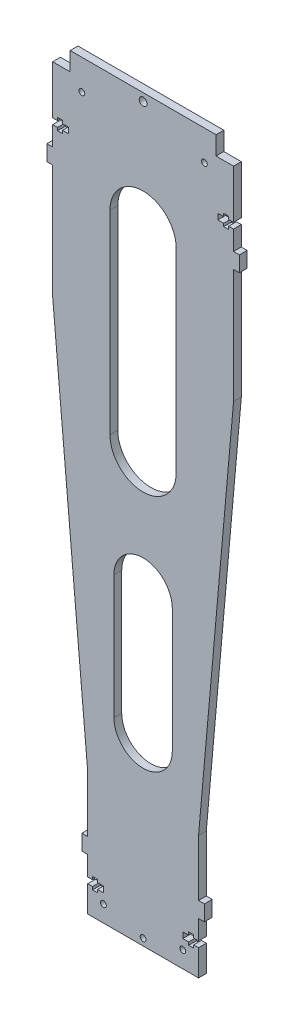
from build123d import *

# Parameters (mm, degrees)
SKETCH_3_R      = 1.5
SKETCH_3_R_2    = 2
EXTRUDE_1_DEPTH = 4


with BuildPart() as part:
    # 草图3 → 凸台-拉伸1 (new body)
    with BuildSketch(Plane.XY):
        Polygon((-46.5, 5.009783315), (-37.5, 5.009783315), (-37.5, 14.509783315), (37.5, 14.509783315), (37.5, 5.009783315), (46.5, 5.009783315), (46.5, -19.990216685), (44, -19.990216685), (44, -18.490216685), (41.4, -18.490216685), (41.4, -19.990216685), (38.4, -19.990216685), (38.4, -22.990216685), (41.4, -22.990216685), (41.4, -24.490216685), (44, -24.490216685), (44, -22.990216685), (46.5, -22.990216685), (46.5, -32.990216685), (49.5, -32.990216685), (49.5, -40.990216685), (46.5, -40.990216685), (46.5, -99.795048798), (28.5, -301.990216685), (28.5, -330.990216685), (31.5, -330.990216685), (31.5, -338.990216685), (28.5, -338.990216685), (28.5, -348.990216685), (26, -348.990216685), (26, -347.490216685), (23.4, -347.490216685), (23.4, -348.990216685), (20.4, -348.990216685), (20.4, -351.990216685), (23.4, -351.990216685), (23.4, -353.490216685), (26, -353.490216685), (26, -351.990216685), (28.5, -351.990216685), (28.5, -365.490216685), (-28.5, -365.490216685), (-28.5, -351.990216685), (-26, -351.990216685), (-26, -353.490216685), (-23.4, -353.490216685), (-23.4, -351.990216685), (-20.4, -351.990216685), (-20.4, -348.990216685), (-23.4, -348.990216685), (-23.4, -347.490216685), (-26, -347.490216685), (-26, -348.990216685), (-28.5, -348.990216685), (-28.5, -338.990216685), (-31.5, -338.990216685), (-31.5, -330.990216685), (-28.5, -330.990216685), (-28.5, -301.990216685), (-46.5, -99.795048798), (-46.5, -40.990216685), (-49.5, -40.990216685), (-49.5, -32.990216685), (-46.5, -32.990216685), (-46.5, -22.990216685), (-44, -22.990216685), (-44, -24.490216685), (-41.4, -24.490216685), (-41.4, -22.990216685), (-38.4, -22.990216685), (-38.4, -19.990216685), (-41.4, -19.990216685), (-41.4, -18.490216685), (-44, -18.490216685), (-44, -19.990216685), (-46.5, -19.990216685), align=None)
        with Locations((-31.5, -0.990216685)):
            Circle(SKETCH_3_R, mode=Mode.SUBTRACT)
        with Locations((0, 10.509783315)):
            Circle(SKETCH_3_R_2, mode=Mode.SUBTRACT)
        with Locations(Location((31.5, -0.990216685, 0), (0, 0, 180))):
            Circle(SKETCH_3_R, mode=Mode.SUBTRACT)
        with Locations((0, -361.990216685)):
            Circle(SKETCH_3_R, mode=Mode.SUBTRACT)
        with Locations((-20.4, -356.990216685)):
            Circle(SKETCH_3_R, mode=Mode.SUBTRACT)
        with Locations(Location((20.4, -356.990216685, 0), (0, 0, 180))):
            Circle(SKETCH_3_R, mode=Mode.SUBTRACT)
        with BuildLine():
            Line((-17.023193691, -146.328074808), (-17.023193691, -46.328074808))
            ThreePointArc((-17.023193691, -46.328074808), (0, -29.304881117), (17.023193691, -46.328074808))
            Line((17.023193691, -46.328074808), (17.023193691, -146.328074808))
            ThreePointArc((17.023193691, -146.328074808), (0, -163.351268499), (-17.023193691, -146.328074808))
        make_face(mode=Mode.SUBTRACT)
        with BuildLine():
            Line((-15, -207.652358563), (-15, -271.328074808))
            ThreePointArc((-15, -271.328074808), (0, -286.328074808), (15, -271.328074808))
            Line((15, -271.328074808), (15, -207.652358563))
            ThreePointArc((15, -207.652358563), (0, -192.652358563), (-15, -207.652358563))
        make_face(mode=Mode.SUBTRACT)
    extrude(amount=EXTRUDE_1_DEPTH)


solid = part.part
